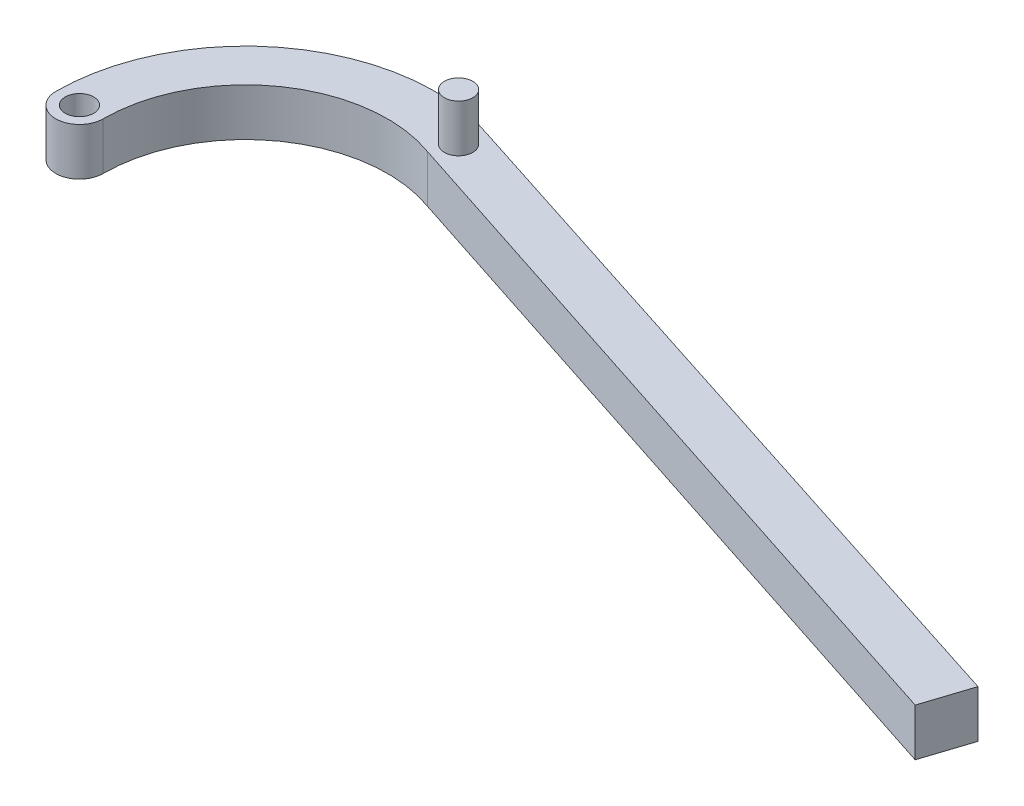
from build123d import *

# Parameters (mm, degrees)
SKETCH1_R           = 20
BOSS_EXTRUDE1_DEPTH = 5
SKETCH2_R           = 15
CUT_EXTRUDE1_DEPTH  = 5
CUT_EXTRUDE2_START  = -5
CUT_EXTRUDE2_DEPTH  = 5
BOSS_EXTRUDE6_DEPTH = 5
BOSS_EXTRUDE7_DEPTH = 5
SKETCH13_R          = 1.5
CUT_EXTRUDE4_DEPTH  = 5
SKETCH14_R          = 1.5
BOSS_EXTRUDE8_DEPTH = 5


with BuildPart() as part:
    # Sketch1 → Boss-Extrude1 (new body)
    with BuildSketch(Plane(origin=(0, 0, 0), x_dir=(1, 0, 0), z_dir=(0, 1, 0))):
        with Locations(Location((0, 0, 0), (0, 0, 270))):
            Circle(SKETCH1_R)
    extrude(amount=BOSS_EXTRUDE1_DEPTH)

    # Sketch2 → Cut-Extrude1 (cut)
    with BuildSketch(Plane(origin=(0, 5, 0), x_dir=(1, 0, 0), z_dir=(0, 1, 0))):
        with Locations(Location((0, 0, 0), (0, 0, 270))):
            Circle(SKETCH2_R)
    extrude(amount=-CUT_EXTRUDE1_DEPTH, mode=Mode.SUBTRACT)

    # Sketch3 → Cut-Extrude2 (cut)
    with BuildSketch(Plane(origin=(0, 5, 0), x_dir=(1, 0, 0), z_dir=(0, 1, 0)).offset(CUT_EXTRUDE2_START)):
        with BuildLine():
            Line((6.840402867, 18.793852416), (0, 0))
            Line((0, 0), (-20, 0))
            ThreePointArc((-20, 0), (11.471528727, -16.383040886), (6.840402867, 18.793852416))
        make_face()
    extrude(amount=CUT_EXTRUDE2_DEPTH, mode=Mode.SUBTRACT)

    # Sketch10 → Boss-Extrude6 (add)
    with BuildSketch(Plane(origin=(0, 5, 0), x_dir=(1, 0, 0), z_dir=(0, 1, 0))):
        Polygon((5.13030215, 14.095389312), (81.360388775, -10.730274846), (82.988726433, -5.730274846), (6.840402867, 18.793852416), align=None)
    extrude(amount=-BOSS_EXTRUDE6_DEPTH)

    # Sketch12 → Boss-Extrude7 (add)
    with BuildSketch(Plane(origin=(0, 5, 0), x_dir=(1, 0, 0), z_dir=(0, 1, 0))):
        with BuildLine():
            Line((-20, 0), (-15, 0))
            ThreePointArc((-15, 0), (-17.5, -2.5), (-20, 0))
        make_face()
    extrude(amount=-BOSS_EXTRUDE7_DEPTH)

    # Sketch13 → Cut-Extrude4 (cut)
    with BuildSketch(Plane(origin=(0, 5, 0), x_dir=(1, 0, 0), z_dir=(0, 1, 0))):
        with Locations(Location((-17.5, 0, 0), (0, 0, 270))):
            Circle(SKETCH13_R)
    extrude(amount=-CUT_EXTRUDE4_DEPTH, mode=Mode.SUBTRACT)

    # Sketch14 → Boss-Extrude8 (add)
    with BuildSketch(Plane(origin=(0, 5, 0), x_dir=(1, 0, 0), z_dir=(0, 1, 0))):
        with Locations(Location((6.065841992, 16.416852345, 0), (0, 0, 270))):
            Circle(SKETCH14_R)
    extrude(amount=BOSS_EXTRUDE8_DEPTH)


solid = part.part
